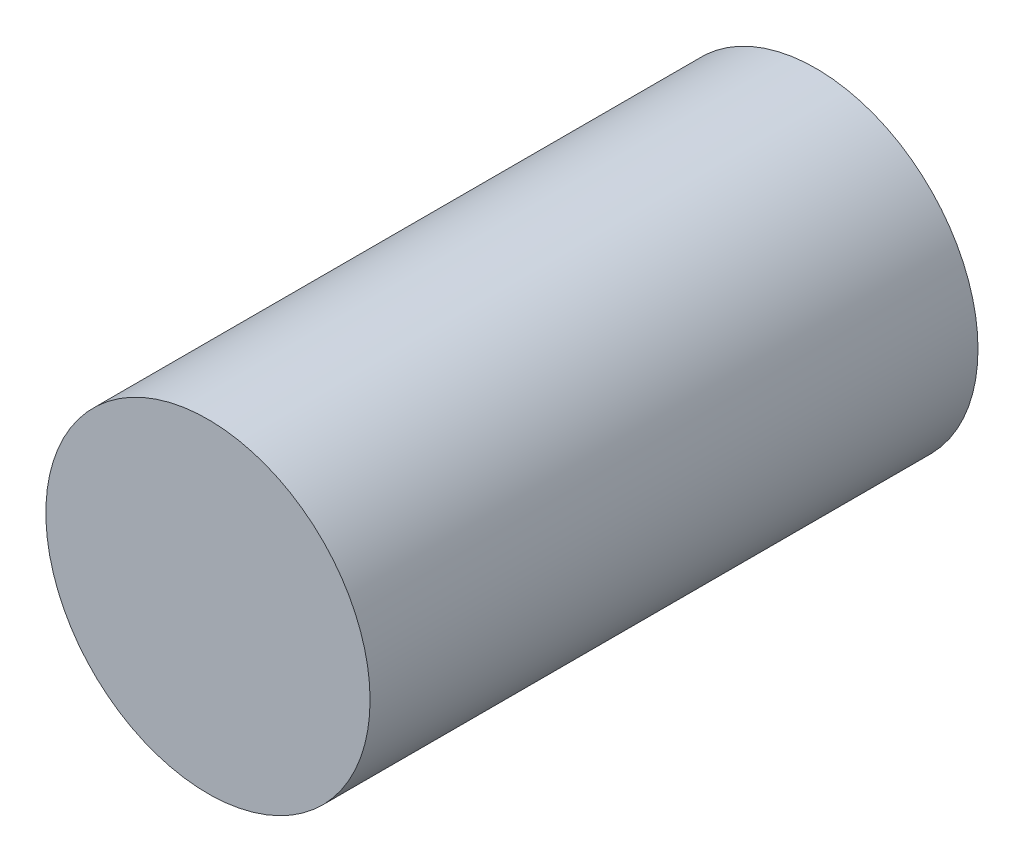
from build123d import *

# Parameters (mm, degrees)
SKETCH1_R           = 40
BOSS_EXTRUDE1_DEPTH = 150


with BuildPart() as part:
    # Sketch1 → Boss-Extrude1 (new body)
    with BuildSketch(Plane.XY):
        Circle(SKETCH1_R)
    extrude(amount=BOSS_EXTRUDE1_DEPTH)


solid = part.part
